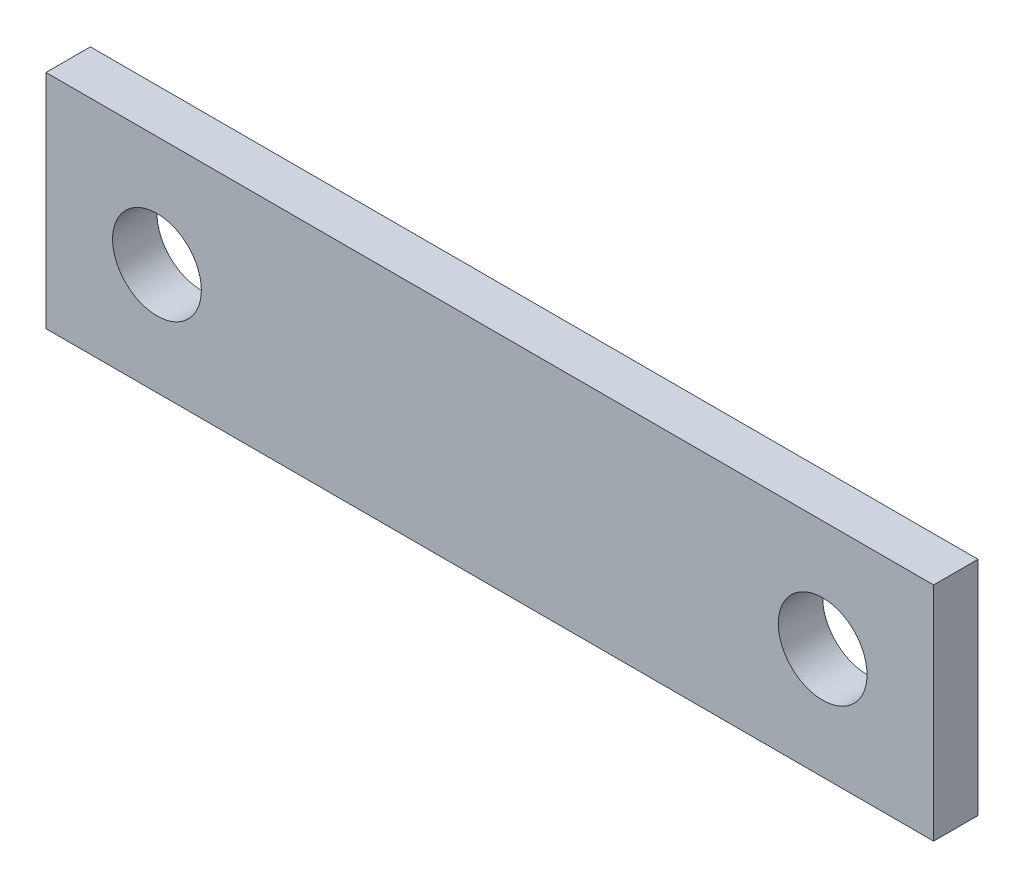
from build123d import *

# Parameters (mm, degrees)
SKETCH_1_W      = 120
SKETCH_1_H      = 30
SKETCH_1_R      = 6
EXTRUDE_1_DEPTH = 6


with BuildPart() as part:
    # 草图1 → 凸台-拉伸1 (new body)
    with BuildSketch(Plane.XY):
        with Locations((60, 15)):
            Rectangle(SKETCH_1_W, SKETCH_1_H)
        with Locations((15, 15)):
            Circle(SKETCH_1_R, mode=Mode.SUBTRACT)
        with Locations((105, 15)):
            Circle(SKETCH_1_R, mode=Mode.SUBTRACT)
    extrude(amount=EXTRUDE_1_DEPTH)


solid = part.part
